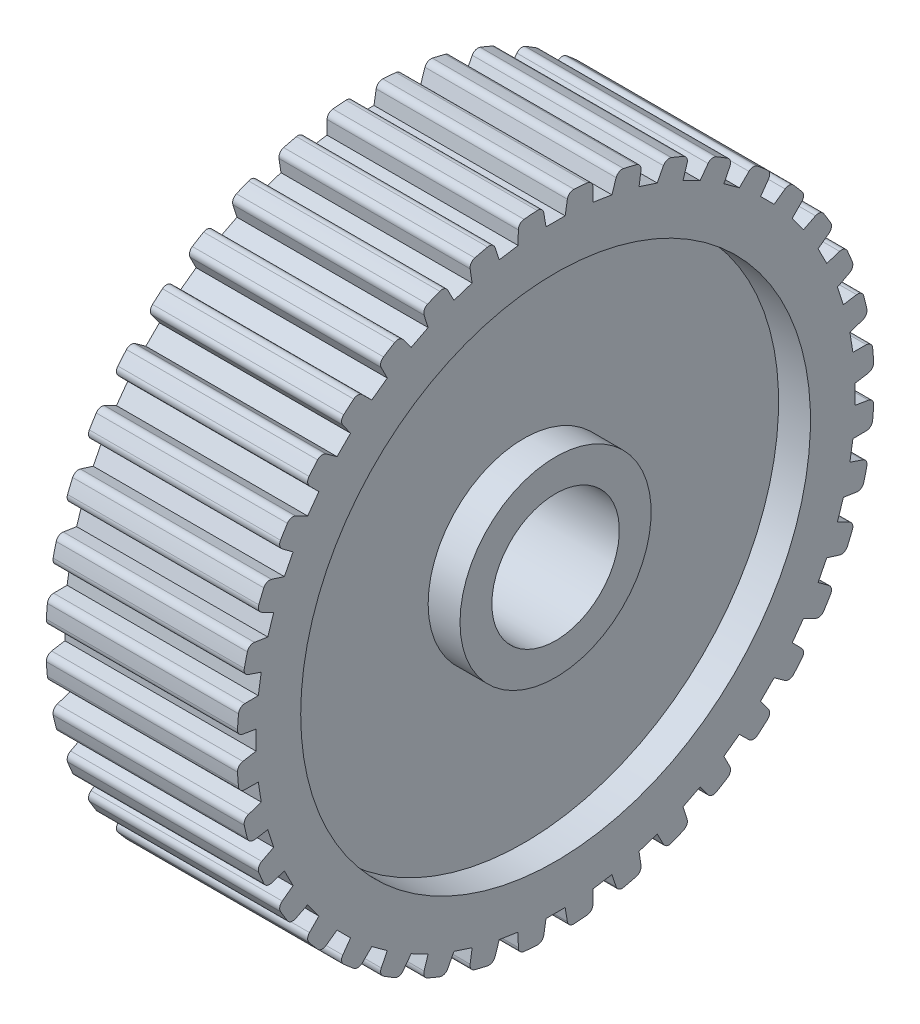
from build123d import *

# Parameters (mm, degrees)
CUT_EXTRUDE1_DEPTH       = 77.811457479
FILLET1_R                = 1
CIRPATTERN1_COUNT        = 40
FILLET1_OF_CIRPATTERN1_R = 1


with BuildPart() as part:
    # Sketch1 → Revolve1 (revolve)
    with BuildSketch(Plane.XY, mode=Mode.PRIVATE) as revolve1_sk:
        Polygon((-15, 10), (15, 10), (15, 15), (10, 15), (10, 40), (15, 40), (15, 50), (-15, 50), (-15, 40), (-10, 40), (-10, 15), (-15, 15), align=None)
    revolve(revolve1_sk.sketch.rotate(Axis((-99.316239316, 0, 0), (1, 0, 0)), 90), axis=Axis((-99.316239316, 0, 0), (1, 0, 0)))

    # Sketch2 → Cut-Extrude1 (cut, symmetric)
    with BuildSketch(Plane(origin=(15, 0, 0), x_dir=(0, 0, -1), z_dir=(1, 0, 0))):
        Polygon((-2.5, 53), (2.5, 53), (1.5, 47), (-1.5, 47), align=None)
    cut_extrude1 = extrude(amount=CUT_EXTRUDE1_DEPTH, both=True, mode=Mode.SUBTRACT)

    # Fillet1
    fillet1_edges = [part.edges().sort_by_distance(p)[0] for p in [
        (0, 49.960248768, 1.993374795),
        (0, 49.960248768, -1.993374795),
    ]]
    fillet(fillet1_edges, radius=FILLET1_R)

    # CirPattern1: Cut-Extrude1 ×40 about axis
    cirpattern1_axis = Axis((0, 0, 0), (1, 0, 0))
    for i in range(1, CIRPATTERN1_COUNT):
        add(cut_extrude1.rotate(cirpattern1_axis, i * 360 / CIRPATTERN1_COUNT), mode=Mode.SUBTRACT)

    # Fillet1 of CirPattern1
    fillet1_of_cirpattern1_edges = [part.edges().sort_by_distance(p)[0] for p in [
        (0, 49.033322681, 9.784337832),
        (0, 49.656987721, 5.846671746),
        (0, 46.899033459, 17.334378),
        (0, 48.131006834, 13.542753825),
        (0, 43.609934383, 24.457588252),
        (0, 45.419880821, 20.905368358),
        (0, 39.24701399, 30.978571512),
        (0, 41.590366603, 27.753223342),
        (0, 33.917701859, 36.736759528),
        (0, 36.736759528, 33.917701859),
        (0, 27.753223342, 41.590366603),
        (0, 30.978571512, 39.24701399),
        (0, 20.905368358, 45.419880821),
        (0, 24.457588252, 43.609934383),
        (0, 13.542753825, 48.131006834),
        (0, 17.334378, 46.899033459),
        (0, 5.846671746, 49.656987721),
        (0, 9.784337832, 49.033322681),
        (0, -1.993374795, 49.960248768),
        (0, 1.993374795, 49.960248768),
        (0, -9.784337832, 49.033322681),
        (0, -5.846671746, 49.656987721),
        (0, -17.334378, 46.899033459),
        (0, -13.542753825, 48.131006834),
        (0, -24.457588252, 43.609934383),
        (0, -20.905368358, 45.419880821),
        (0, -30.978571512, 39.24701399),
        (0, -27.753223342, 41.590366603),
        (0, -36.736759528, 33.917701859),
        (0, -33.917701859, 36.736759528),
        (0, -41.590366603, 27.753223342),
        (0, -39.24701399, 30.978571512),
        (0, -45.419880821, 20.905368358),
        (0, -43.609934383, 24.457588252),
        (0, -48.131006834, 13.542753825),
        (0, -46.899033459, 17.334378),
        (0, -49.656987721, 5.846671746),
        (0, -49.033322681, 9.784337832),
        (0, -49.960248768, -1.993374795),
        (0, -49.960248768, 1.993374795),
        (0, -49.033322681, -9.784337832),
        (0, -49.656987721, -5.846671746),
        (0, -46.899033459, -17.334378),
        (0, -48.131006834, -13.542753825),
        (0, -43.609934383, -24.457588252),
        (0, -45.419880821, -20.905368358),
        (0, -39.24701399, -30.978571512),
        (0, -41.590366603, -27.753223342),
        (0, -33.917701859, -36.736759528),
        (0, -36.736759528, -33.917701859),
        (0, -27.753223342, -41.590366603),
        (0, -30.978571512, -39.24701399),
        (0, -20.905368358, -45.419880821),
        (0, -24.457588252, -43.609934383),
        (0, -13.542753825, -48.131006834),
        (0, -17.334378, -46.899033459),
        (0, -5.846671746, -49.656987721),
        (0, -9.784337832, -49.033322681),
        (0, 1.993374795, -49.960248768),
        (0, -1.993374795, -49.960248768),
        (0, 9.784337832, -49.033322681),
        (0, 5.846671746, -49.656987721),
        (0, 17.334378, -46.899033459),
        (0, 13.542753825, -48.131006834),
        (0, 24.457588252, -43.609934383),
        (0, 20.905368358, -45.419880821),
        (0, 30.978571512, -39.24701399),
        (0, 27.753223342, -41.590366603),
        (0, 36.736759528, -33.917701859),
        (0, 33.917701859, -36.736759528),
        (0, 41.590366603, -27.753223342),
        (0, 39.24701399, -30.978571512),
        (0, 45.419880821, -20.905368358),
        (0, 43.609934383, -24.457588252),
        (0, 48.131006834, -13.542753825),
        (0, 46.899033459, -17.334378),
        (0, 49.656987721, -5.846671746),
        (0, 49.033322681, -9.784337832),
    ]]
    fillet(fillet1_of_cirpattern1_edges, radius=FILLET1_OF_CIRPATTERN1_R)


solid = part.part
